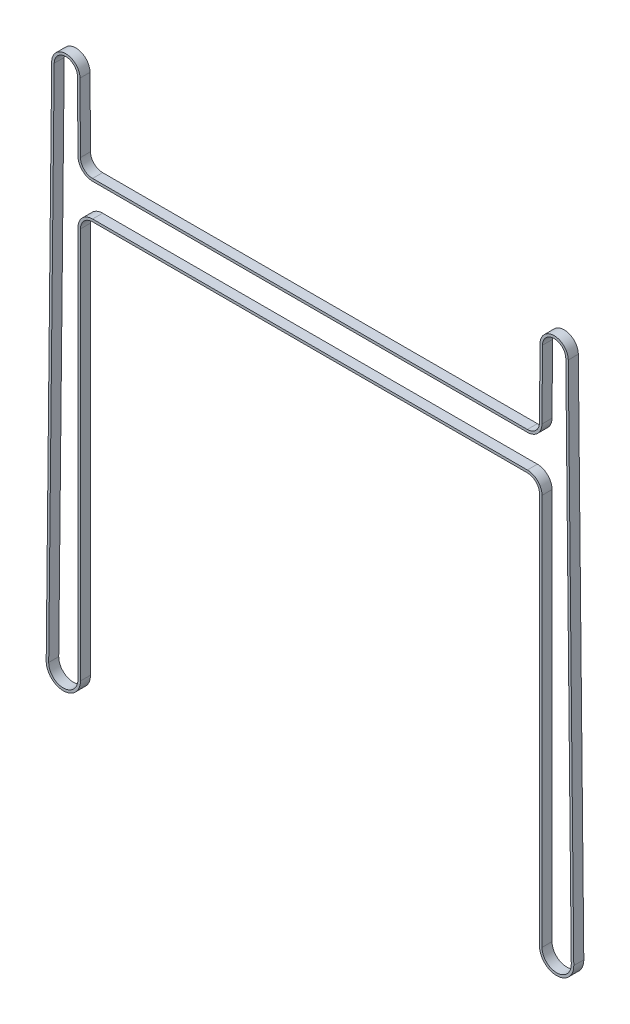
from build123d import *

# Parameters (mm, degrees)
EXTRUDE_1_DEPTH = 6


with BuildPart() as part:
    # Эскиз2 → Вытянуть-Тонкостенный1 (new body)
    with BuildSketch(Plane.XY):
        with BuildLine():
            Line((-14.566061587, -38.72801898), (-14.281683106, 2.247366132))
            ThreePointArc((-14.281683106, 2.247366132), (-5.832089519, 10.653604872), (2.64764356, 2.277770081))
            Line((2.64764356, 2.277770081), (5.933544507, -309.703420152))
            ThreePointArc((5.933544507, -309.703420152), (-4.262949336, -320.062239574), (-14.567886964, -309.811293911))
            Line((-14.567886964, -309.811293911), (-14.565886965, -75.677758544))
            ThreePointArc((-14.565886965, -75.677758544), (-16.689633795, -70.550487234), (-21.816886964, -68.426696605))
            Line((-21.816886964, -68.426696605), (-281.816886964, -68.426696605))
            ThreePointArc((-281.816886964, -68.426696605), (-286.944140134, -70.550487234), (-289.067886964, -75.677758544))
            Line((-289.067886964, -75.677758544), (-289.065886965, -309.811293911))
            ThreePointArc((-289.065886965, -309.811293911), (-299.370824593, -320.062239574), (-309.567318436, -309.703420152))
            Line((-309.567318436, -309.703420152), (-306.281417489, 2.277770081))
            ThreePointArc((-306.281417489, 2.277770081), (-297.80168441, 10.653604872), (-289.352090823, 2.247366132))
            Line((-289.352090823, 2.247366132), (-289.067712342, -38.72801898))
            ThreePointArc((-289.067712342, -38.72801898), (-286.926295612, -43.82268876), (-281.816886964, -45.928696605))
            Line((-281.816886964, -45.928696605), (-21.816886964, -45.928696605))
            ThreePointArc((-21.816886964, -45.928696605), (-16.707478317, -43.82268876), (-14.566061587, -38.72801898))
        make_face()
        with BuildLine():
            Line((-13.06609771, -38.73842907), (-12.78171923, 2.236956042))
            ThreePointArc((-12.78171923, 2.236956042), (-5.829395623, 9.153607291), (1.147726751, 2.261972404))
            Line((1.147726751, 2.261972404), (4.433627698, -309.719217829))
            ThreePointArc((4.433627698, -309.719217829), (-4.270841877, -318.562260338), (-13.067886964, -309.811306724))
            Line((-13.067886964, -309.811306724), (-13.065886965, -75.677771357))
            ThreePointArc((-13.065886965, -75.677771357), (-15.628969093, -69.489831592), (-21.816886964, -66.926696605))
            Line((-21.816886964, -66.926696605), (-281.816886964, -66.926696605))
            ThreePointArc((-281.816886964, -66.926696605), (-288.004804835, -69.489831592), (-290.567886964, -75.677771357))
            Line((-290.567886964, -75.677771357), (-290.565886965, -309.811306724))
            ThreePointArc((-290.565886965, -309.811306724), (-299.362932052, -318.562260338), (-308.067401627, -309.719217829))
            Line((-308.067401627, -309.719217829), (-304.78150068, 2.261972404))
            ThreePointArc((-304.78150068, 2.261972404), (-297.804378306, 9.153607291), (-290.852054699, 2.236956042))
            Line((-290.852054699, 2.236956042), (-290.567676218, -38.73842907))
            ThreePointArc((-290.567676218, -38.73842907), (-287.983268853, -44.88702309), (-281.816886964, -47.428696605))
            Line((-281.816886964, -47.428696605), (-21.816886964, -47.428696605))
            ThreePointArc((-21.816886964, -47.428696605), (-15.650505076, -44.88702309), (-13.06609771, -38.73842907))
        make_face(mode=Mode.SUBTRACT)
    extrude(amount=EXTRUDE_1_DEPTH)


solid = part.part
